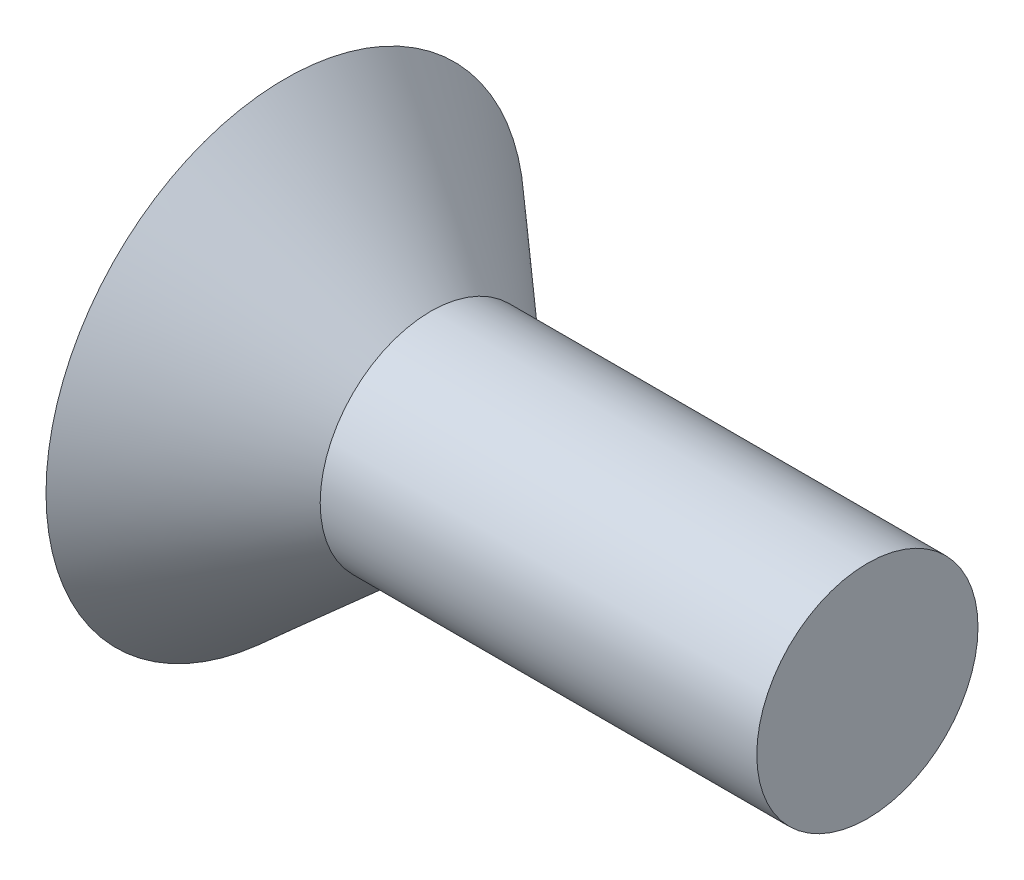
from build123d import *

# Parameters (mm, degrees)
CUT_EXTRUDE1_DEPTH = 2.54
FILLET1_R          = 0.0508


with BuildPart() as part:
    # Sketch1 → Revolve2 (revolve)
    with BuildSketch(Plane.XY):
        Polygon((0, 0), (0, 2.413), (-9.525, 2.413), (-12.7, 5.2197), (-12.7, 0), align=None)
    revolve(axis=Axis((-12.7, 0, 0), (1, 0, 0)))

    # Sketch2 → Cut-Extrude1 (cut)
    with BuildSketch(Plane.ZY.offset(12.7)):
        Polygon((0, 1.833087105), (-1.5875, 0.916543552), (-1.5875, -0.916543552), (0, -1.833087105), (1.5875, -0.916543552), (1.5875, 0.916543552), align=None)
    extrude(amount=-CUT_EXTRUDE1_DEPTH, mode=Mode.SUBTRACT)

    # Fillet1
    fillet1_edges = [part.edges().sort_by_distance(p)[0] for p in [
        (-12.7, -1.374815329, 0.79375),
        (-12.7, -1.374815329, -0.79375),
        (-12.7, 0, -1.5875),
        (-12.7, 1.374815329, -0.79375),
        (-12.7, 1.374815329, 0.79375),
        (-12.7, 0, 1.5875),
    ]]
    fillet(fillet1_edges, radius=FILLET1_R)


solid = part.part
